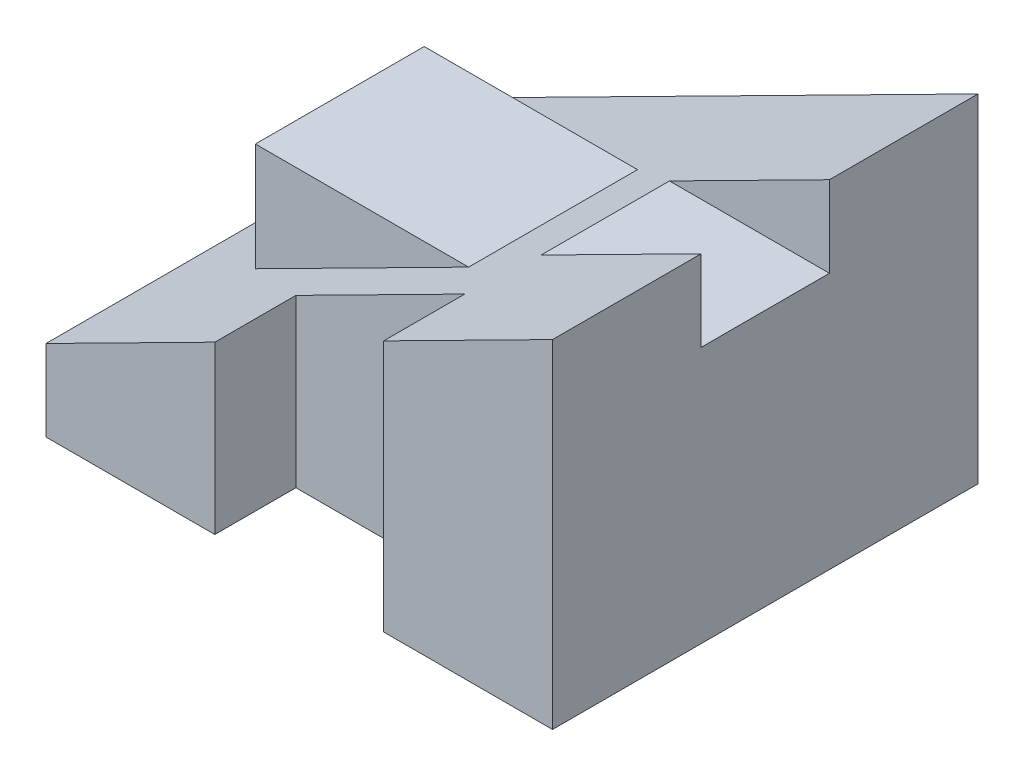
from build123d import *

# Parameters (mm, degrees)
BOSS_EXTRUDE1_DEPTH   = 63
BOSS_EXTRUDE1_2_DEPTH = 63
BOSS_EXTRUDE2_START   = -12
BOSS_EXTRUDE2_DEPTH   = 51
BOSS_EXTRUDE3_START   = -19
BOSS_EXTRUDE3_DEPTH   = 25
BOSS_EXTRUDE4_START   = -41
BOSS_EXTRUDE4_DEPTH   = 22
BOSS_EXTRUDE5_DEPTH   = 22


with BuildPart() as part:
    # Sketch1 → Boss-Extrude1 (new body)
    with BuildSketch(Plane.XY):
        Polygon((-25, 0), (0, 0), (0, 38), (-23.684210526, 38), (-25, 37.333333333), align=None)
    extrude(amount=-BOSS_EXTRUDE1_DEPTH)



with BuildPart() as body_2:
    # Sketch1 → Boss-Extrude1 2 (new body)
    with BuildSketch(Plane.XY):
        Polygon((-75, 0), (-50, 0), (-50, 24.666666667), (-75, 12), align=None)
    extrude(amount=-BOSS_EXTRUDE1_2_DEPTH)


with BuildPart() as part_1:
    add(part.part)

    add(body_2.part)  # Boss-Extrude2 merges body 2
    # Sketch1<3> → Boss-Extrude2 (add)
    with BuildSketch(Plane.XY.offset(BOSS_EXTRUDE2_START)):
        Polygon((-50, 0), (-25, 0), (-25, 37.333333333), (-31.421052632, 34.08), (-50, 24.666666667), align=None)
    extrude(amount=-BOSS_EXTRUDE2_DEPTH)

    # Sketch1<4> → Boss-Extrude3 (add)
    with BuildSketch(Plane.XY.offset(BOSS_EXTRUDE3_START)):
        Polygon((-63, 18.08), (-50, 24.666666667), (-31.421052632, 34.08), (-63, 34.08), align=None)
    extrude(amount=-BOSS_EXTRUDE3_DEPTH)

    # Sketch1<5> → Boss-Extrude4 (add)
    with BuildSketch(Plane.XY.offset(BOSS_EXTRUDE4_START)):
        Polygon((-23.684210526, 38), (0, 38), (0, 50), align=None)
    extrude(amount=-BOSS_EXTRUDE4_DEPTH)

    # Sketch1<6> → Boss-Extrude5 (add)
    with BuildSketch(Plane.XY):
        Polygon((-23.684210526, 38), (0, 38), (0, 50), align=None)
    extrude(amount=-BOSS_EXTRUDE5_DEPTH)


solid = part_1.part
